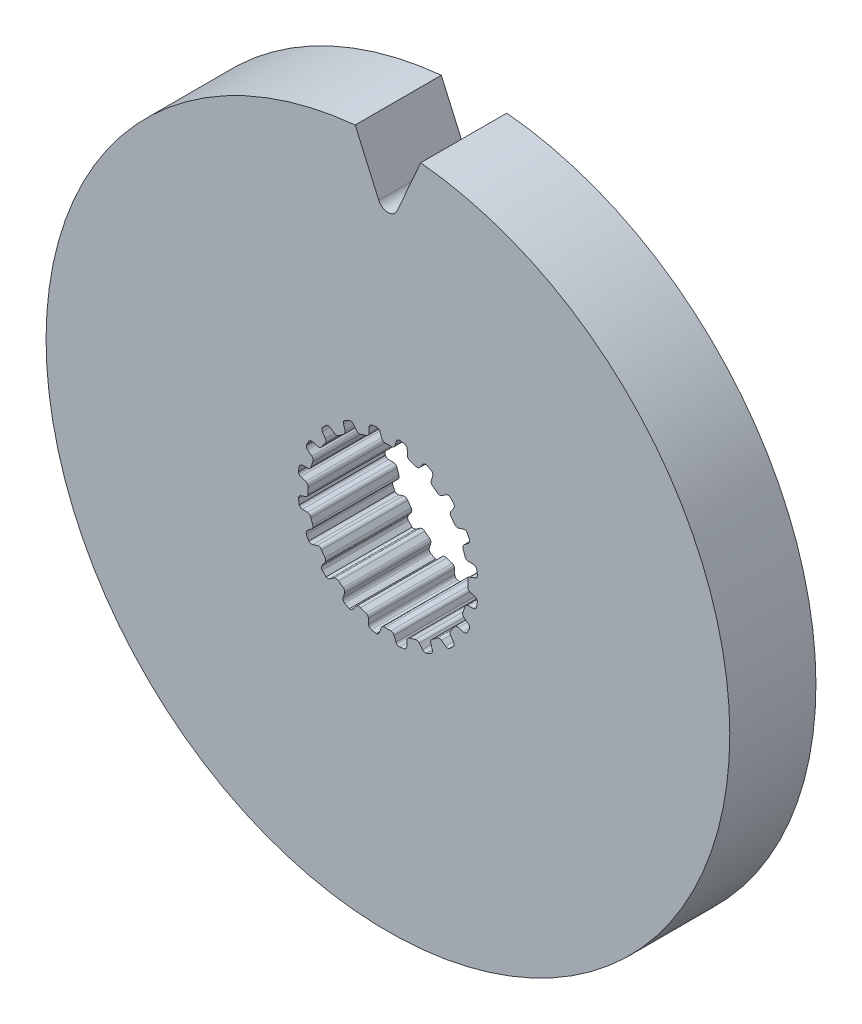
from build123d import *

# Parameters (mm, degrees)
SKETCH1_R           = 12.7
BOSS_EXTRUDE1_DEPTH = 1.6002
CUT_EXTRUDE1_DEPTH  = 3.2004


with BuildPart() as part:
    # Sketch1 → Boss-Extrude1 (new, symmetric)
    with BuildSketch(Plane.XY):
        Circle(SKETCH1_R)
        with BuildLine():
            Line((-0.106949245, 2.969874934), (0.106949245, 2.969874934))
            ThreePointArc((0.106949245, 2.969874934), (0.196343213, 2.986924176), (0.253739238, 3.057547504))
            Line((0.253739238, 3.057547504), (0.315888147, 3.237526941))
            ThreePointArc((0.315888147, 3.237526941), (0.359032156, 3.298322911), (0.4281449, 3.326269005))
            Line((0.4281449, 3.326269005), (0.620027588, 3.2937547))
            ThreePointArc((0.620027588, 3.2937547), (0.689621142, 3.24802576), (0.718272212, 3.169836791))
            Line((0.718272212, 3.169836791), (0.724389167, 2.979527391))
            ThreePointArc((0.724389167, 2.979527391), (0.750934762, 2.9040661), (0.816027049, 2.857568043))
            Line((0.816027049, 2.857568043), (1.019456602, 2.791469774))
            ThreePointArc((1.019456602, 2.791469774), (1.109743823, 2.780060312), (1.186154496, 2.829490741))
            Line((1.186154496, 2.829490741), (1.300878326, 2.981456288))
            ThreePointArc((1.300878326, 2.981456288), (1.360697704, 3.02594446), (1.435063648, 3.031165762))
            Line((1.435063648, 3.031165762), (1.607507455, 2.940947809))
            ThreePointArc((1.607507455, 2.940947809), (1.659563839, 2.875951412), (1.662650905, 2.792735615))
            Line((1.662650905, 2.792735615), (1.609659636, 2.609850378))
            ThreePointArc((1.609659636, 2.609850378), (1.611587176, 2.529879385), (1.659124931, 2.465542482))
            Line((1.659124931, 2.465542482), (1.832172444, 2.339816104))
            ThreePointArc((1.832172444, 2.339816104), (1.914514976, 2.301064775), (2.002460687, 2.32446371))
            Line((2.002460687, 2.32446371), (2.158529469, 2.433539921))
            ThreePointArc((2.158529469, 2.433539921), (2.229168681, 2.457365482), (2.301508367, 2.439350895))
            Line((2.301508367, 2.439350895), (2.437633293, 2.300260456))
            ThreePointArc((2.437633293, 2.300260456), (2.467056864, 2.222358901), (2.444277744, 2.14226202))
            Line((2.444277744, 2.14226202), (2.337365406, 1.984703026))
            ThreePointArc((2.337365406, 1.984703026), (2.314486209, 1.908050449), (2.339816104, 1.832172444))
            Line((2.339816104, 1.832172444), (2.465542482, 1.659124931))
            ThreePointArc((2.465542482, 1.659124931), (2.531880064, 1.596824985), (2.622752074, 1.591901975))
            Line((2.622752074, 1.591901975), (2.804888709, 1.64741171))
            ThreePointArc((2.804888709, 1.64741171), (2.879433095, 1.648242449), (2.942665411, 1.608755366))
            Line((2.942665411, 1.608755366), (3.0291466, 1.434407582))
            ThreePointArc((3.0291466, 1.434407582), (3.033057175, 1.351226417), (2.986641646, 1.282088892))
            Line((2.986641646, 1.282088892), (2.836273564, 1.165279113))
            ThreePointArc((2.836273564, 1.165279113), (2.790827206, 1.099448241), (2.791469774, 1.019456602))
            Line((2.791469774, 1.019456602), (2.857568043, 0.816027049))
            ThreePointArc((2.857568043, 0.816027049), (2.901407091, 0.736276839), (2.986310214, 0.703513784))
            Line((2.986310214, 0.703513784), (3.1766859, 0.700023363))
            ThreePointArc((3.1766859, 0.700023363), (3.247838536, 0.677777961), (3.295773863, 0.620683653))
            Line((3.295773863, 0.620683653), (3.324145932, 0.4281449))
            ThreePointArc((3.324145932, 0.4281449), (3.302160717, 0.347826477), (3.236652255, 0.29641597))
            Line((3.236652255, 0.29641597), (3.057547504, 0.231789562))
            ThreePointArc((3.057547504, 0.231789562), (2.993982591, 0.183224379), (2.969874934, 0.106949245))
            Line((2.969874934, 0.106949245), (2.969874934, -0.106949245))
            ThreePointArc((2.969874934, -0.106949245), (2.986924176, -0.196343213), (3.057547504, -0.253739238))
            Line((3.057547504, -0.253739238), (3.237526941, -0.315888147))
            ThreePointArc((3.237526941, -0.315888147), (3.298322911, -0.359032156), (3.326269005, -0.4281449))
            Line((3.326269005, -0.4281449), (3.2937547, -0.620027588))
            ThreePointArc((3.2937547, -0.620027588), (3.24802576, -0.689621142), (3.169836791, -0.718272212))
            Line((3.169836791, -0.718272212), (2.979527391, -0.724389167))
            ThreePointArc((2.979527391, -0.724389167), (2.9040661, -0.750934762), (2.857568043, -0.816027049))
            Line((2.857568043, -0.816027049), (2.791469774, -1.019456602))
            ThreePointArc((2.791469774, -1.019456602), (2.780060312, -1.109743823), (2.829490741, -1.186154496))
            Line((2.829490741, -1.186154496), (2.981456288, -1.300878326))
            ThreePointArc((2.981456288, -1.300878326), (3.02594446, -1.360697704), (3.031165762, -1.435063648))
            Line((3.031165762, -1.435063648), (2.940947809, -1.607507455))
            ThreePointArc((2.940947809, -1.607507455), (2.875951412, -1.659563839), (2.792735615, -1.662650905))
            Line((2.792735615, -1.662650905), (2.609850378, -1.609659636))
            ThreePointArc((2.609850378, -1.609659636), (2.529879385, -1.611587176), (2.465542482, -1.659124931))
            Line((2.465542482, -1.659124931), (2.339816104, -1.832172444))
            ThreePointArc((2.339816104, -1.832172444), (2.301064775, -1.914514976), (2.32446371, -2.002460687))
            Line((2.32446371, -2.002460687), (2.433539921, -2.158529469))
            ThreePointArc((2.433539921, -2.158529469), (2.457365482, -2.229168681), (2.439350895, -2.301508367))
            Line((2.439350895, -2.301508367), (2.300260456, -2.437633293))
            ThreePointArc((2.300260456, -2.437633293), (2.222358901, -2.467056864), (2.14226202, -2.444277744))
            Line((2.14226202, -2.444277744), (1.984703026, -2.337365406))
            ThreePointArc((1.984703026, -2.337365406), (1.908050449, -2.314486209), (1.832172444, -2.339816104))
            Line((1.832172444, -2.339816104), (1.659124931, -2.465542482))
            ThreePointArc((1.659124931, -2.465542482), (1.596824985, -2.531880064), (1.591901975, -2.622752074))
            Line((1.591901975, -2.622752074), (1.64741171, -2.804888709))
            ThreePointArc((1.64741171, -2.804888709), (1.648242449, -2.879433095), (1.608755366, -2.942665411))
            Line((1.608755366, -2.942665411), (1.434407582, -3.0291466))
            ThreePointArc((1.434407582, -3.0291466), (1.351226417, -3.033057175), (1.282088892, -2.986641646))
            Line((1.282088892, -2.986641646), (1.165279113, -2.836273564))
            ThreePointArc((1.165279113, -2.836273564), (1.099448241, -2.790827206), (1.019456602, -2.791469774))
            Line((1.019456602, -2.791469774), (0.816027049, -2.857568043))
            ThreePointArc((0.816027049, -2.857568043), (0.736276839, -2.901407091), (0.703513784, -2.986310214))
            Line((0.703513784, -2.986310214), (0.700023363, -3.1766859))
            ThreePointArc((0.700023363, -3.1766859), (0.677777961, -3.247838536), (0.620683653, -3.295773863))
            Line((0.620683653, -3.295773863), (0.4281449, -3.324145932))
            ThreePointArc((0.4281449, -3.324145932), (0.347826477, -3.302160717), (0.29641597, -3.236652255))
            Line((0.29641597, -3.236652255), (0.231789562, -3.057547504))
            ThreePointArc((0.231789562, -3.057547504), (0.183224379, -2.993982591), (0.106949245, -2.969874934))
            Line((0.106949245, -2.969874934), (-0.106949245, -2.969874934))
            ThreePointArc((-0.106949245, -2.969874934), (-0.196343213, -2.986924176), (-0.253739238, -3.057547504))
            Line((-0.253739238, -3.057547504), (-0.315888147, -3.237526941))
            ThreePointArc((-0.315888147, -3.237526941), (-0.359032156, -3.298322911), (-0.4281449, -3.326269005))
            Line((-0.4281449, -3.326269005), (-0.620027588, -3.2937547))
            ThreePointArc((-0.620027588, -3.2937547), (-0.689621142, -3.24802576), (-0.718272212, -3.169836791))
            Line((-0.718272212, -3.169836791), (-0.724389167, -2.979527391))
            ThreePointArc((-0.724389167, -2.979527391), (-0.750934762, -2.9040661), (-0.816027049, -2.857568043))
            Line((-0.816027049, -2.857568043), (-1.019456602, -2.791469774))
            ThreePointArc((-1.019456602, -2.791469774), (-1.109743823, -2.780060312), (-1.186154496, -2.829490741))
            Line((-1.186154496, -2.829490741), (-1.300878326, -2.981456288))
            ThreePointArc((-1.300878326, -2.981456288), (-1.360697704, -3.02594446), (-1.435063648, -3.031165762))
            Line((-1.435063648, -3.031165762), (-1.607507455, -2.940947809))
            ThreePointArc((-1.607507455, -2.940947809), (-1.659563839, -2.875951412), (-1.662650905, -2.792735615))
            Line((-1.662650905, -2.792735615), (-1.609659636, -2.609850378))
            ThreePointArc((-1.609659636, -2.609850378), (-1.611587176, -2.529879385), (-1.659124931, -2.465542482))
            Line((-1.659124931, -2.465542482), (-1.832172444, -2.339816104))
            ThreePointArc((-1.832172444, -2.339816104), (-1.914514976, -2.301064775), (-2.002460687, -2.32446371))
            Line((-2.002460687, -2.32446371), (-2.158529469, -2.433539921))
            ThreePointArc((-2.158529469, -2.433539921), (-2.229168681, -2.457365482), (-2.301508367, -2.439350895))
            Line((-2.301508367, -2.439350895), (-2.437633293, -2.300260456))
            ThreePointArc((-2.437633293, -2.300260456), (-2.467056864, -2.222358901), (-2.444277744, -2.14226202))
            Line((-2.444277744, -2.14226202), (-2.337365406, -1.984703026))
            ThreePointArc((-2.337365406, -1.984703026), (-2.314486209, -1.908050449), (-2.339816104, -1.832172444))
            Line((-2.339816104, -1.832172444), (-2.465542482, -1.659124931))
            ThreePointArc((-2.465542482, -1.659124931), (-2.531880064, -1.596824985), (-2.622752074, -1.591901975))
            Line((-2.622752074, -1.591901975), (-2.804888709, -1.64741171))
            ThreePointArc((-2.804888709, -1.64741171), (-2.879433095, -1.648242449), (-2.942665411, -1.608755366))
            Line((-2.942665411, -1.608755366), (-3.0291466, -1.434407582))
            ThreePointArc((-3.0291466, -1.434407582), (-3.033057175, -1.351226417), (-2.986641646, -1.282088892))
            Line((-2.986641646, -1.282088892), (-2.836273564, -1.165279113))
            ThreePointArc((-2.836273564, -1.165279113), (-2.790827206, -1.099448241), (-2.791469774, -1.019456602))
            Line((-2.791469774, -1.019456602), (-2.857568043, -0.816027049))
            ThreePointArc((-2.857568043, -0.816027049), (-2.901407091, -0.736276839), (-2.986310214, -0.703513784))
            Line((-2.986310214, -0.703513784), (-3.1766859, -0.700023363))
            ThreePointArc((-3.1766859, -0.700023363), (-3.247838536, -0.677777961), (-3.295773863, -0.620683653))
            Line((-3.295773863, -0.620683653), (-3.324145932, -0.4281449))
            ThreePointArc((-3.324145932, -0.4281449), (-3.302160717, -0.347826477), (-3.236652255, -0.29641597))
            Line((-3.236652255, -0.29641597), (-3.057547504, -0.231789562))
            ThreePointArc((-3.057547504, -0.231789562), (-2.993982591, -0.183224379), (-2.969874934, -0.106949245))
            Line((-2.969874934, -0.106949245), (-2.969874934, 0.106949245))
            ThreePointArc((-2.969874934, 0.106949245), (-2.986924176, 0.196343213), (-3.057547504, 0.253739238))
            Line((-3.057547504, 0.253739238), (-3.237526941, 0.315888147))
            ThreePointArc((-3.237526941, 0.315888147), (-3.298322911, 0.359032156), (-3.326269005, 0.4281449))
            Line((-3.326269005, 0.4281449), (-3.2937547, 0.620027588))
            ThreePointArc((-3.2937547, 0.620027588), (-3.24802576, 0.689621142), (-3.169836791, 0.718272212))
            Line((-3.169836791, 0.718272212), (-2.979527391, 0.724389167))
            ThreePointArc((-2.979527391, 0.724389167), (-2.9040661, 0.750934762), (-2.857568043, 0.816027049))
            Line((-2.857568043, 0.816027049), (-2.791469774, 1.019456602))
            ThreePointArc((-2.791469774, 1.019456602), (-2.780060312, 1.109743823), (-2.829490741, 1.186154496))
            Line((-2.829490741, 1.186154496), (-2.981456288, 1.300878326))
            ThreePointArc((-2.981456288, 1.300878326), (-3.02594446, 1.360697704), (-3.031165762, 1.435063648))
            Line((-3.031165762, 1.435063648), (-2.940947809, 1.607507455))
            ThreePointArc((-2.940947809, 1.607507455), (-2.875951412, 1.659563839), (-2.792735615, 1.662650905))
            Line((-2.792735615, 1.662650905), (-2.609850378, 1.609659636))
            ThreePointArc((-2.609850378, 1.609659636), (-2.529879385, 1.611587176), (-2.465542482, 1.659124931))
            Line((-2.465542482, 1.659124931), (-2.339816104, 1.832172444))
            ThreePointArc((-2.339816104, 1.832172444), (-2.301064775, 1.914514976), (-2.32446371, 2.002460687))
            Line((-2.32446371, 2.002460687), (-2.433539921, 2.158529469))
            ThreePointArc((-2.433539921, 2.158529469), (-2.457365482, 2.229168681), (-2.439350895, 2.301508367))
            Line((-2.439350895, 2.301508367), (-2.300260456, 2.437633293))
            ThreePointArc((-2.300260456, 2.437633293), (-2.222358901, 2.467056864), (-2.14226202, 2.444277744))
            Line((-2.14226202, 2.444277744), (-1.984703026, 2.337365406))
            ThreePointArc((-1.984703026, 2.337365406), (-1.908050449, 2.314486209), (-1.832172444, 2.339816104))
            Line((-1.832172444, 2.339816104), (-1.659124931, 2.465542482))
            ThreePointArc((-1.659124931, 2.465542482), (-1.596824985, 2.531880064), (-1.591901975, 2.622752074))
            Line((-1.591901975, 2.622752074), (-1.64741171, 2.804888709))
            ThreePointArc((-1.64741171, 2.804888709), (-1.648242449, 2.879433095), (-1.608755366, 2.942665411))
            Line((-1.608755366, 2.942665411), (-1.434407582, 3.0291466))
            ThreePointArc((-1.434407582, 3.0291466), (-1.351226417, 3.033057175), (-1.282088892, 2.986641646))
            Line((-1.282088892, 2.986641646), (-1.165279113, 2.836273564))
            ThreePointArc((-1.165279113, 2.836273564), (-1.099448241, 2.790827206), (-1.019456602, 2.791469774))
            Line((-1.019456602, 2.791469774), (-0.816027049, 2.857568043))
            ThreePointArc((-0.816027049, 2.857568043), (-0.736276839, 2.901407091), (-0.703513784, 2.986310214))
            Line((-0.703513784, 2.986310214), (-0.700023363, 3.1766859))
            ThreePointArc((-0.700023363, 3.1766859), (-0.677777961, 3.247838536), (-0.620683653, 3.295773863))
            Line((-0.620683653, 3.295773863), (-0.4281449, 3.324145932))
            ThreePointArc((-0.4281449, 3.324145932), (-0.347826477, 3.302160717), (-0.29641597, 3.236652255))
            Line((-0.29641597, 3.236652255), (-0.231789562, 3.057547504))
            ThreePointArc((-0.231789562, 3.057547504), (-0.183224379, 2.993982591), (-0.106949245, 2.969874934))
        make_face(mode=Mode.SUBTRACT)
    extrude(amount=BOSS_EXTRUDE1_DEPTH, both=True)

    # Sketch2 → Cut-Extrude1 (cut)
    with BuildSketch(Plane.XY.offset(1.6002)):
        with BuildLine():
            Line((-1.216424981, 12.641610272), (-0.340595019, 10.658010116))
            ThreePointArc((-0.340595019, 10.658010116), (0, 10.436077104), (0.340595019, 10.658010116))
            Line((0.340595019, 10.658010116), (1.216424981, 12.641610272))
            ThreePointArc((1.216424981, 12.641610272), (0, 12.7), (-1.216424981, 12.641610272))
        make_face()
    extrude(amount=-CUT_EXTRUDE1_DEPTH, mode=Mode.SUBTRACT)


solid = part.part
